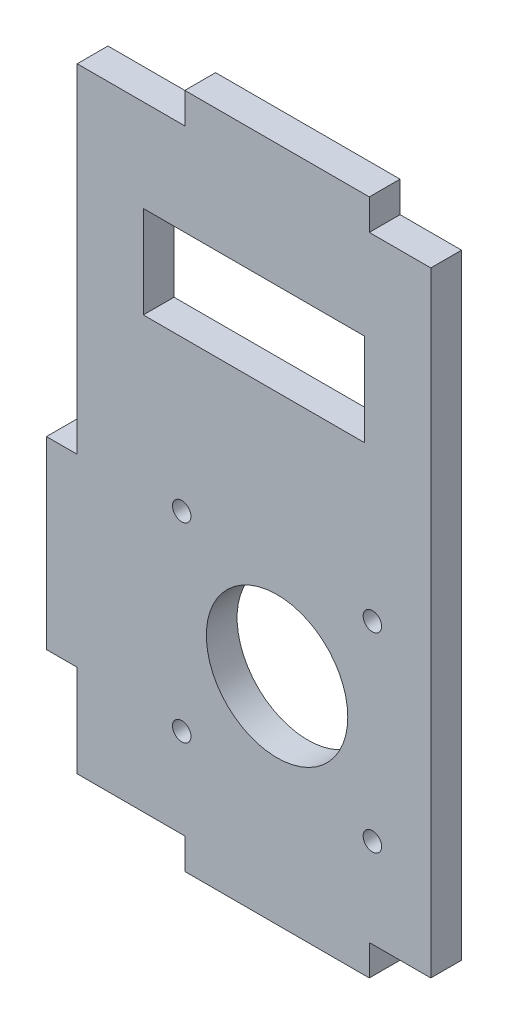
from build123d import *

# Parameters (mm, degrees)
SKETCH_1_R      = 11.5
SKETCH_1_R_2    = 1.5
SKETCH_1_W      = 36
SKETCH_1_H      = 15
EXTRUDE_1_DEPTH = 5


with BuildPart() as part:
    # 草图1 → 凸台-拉伸1 (new body)
    with BuildSketch(Plane.XY):
        Polygon((-2.5, 100), (15, 100), (15, 105), (45, 105), (45, 100), (55, 100), (55, 0), (45, 0), (45, -5), (15, -5), (15, 0), (-2.5, 0), (-2.5, 15), (-7.5, 15), (-7.5, 45), (-2.5, 45), align=None)
        with Locations((30, 30)):
            Circle(SKETCH_1_R, mode=Mode.SUBTRACT)
        with Locations((14.5, 45.5)):
            Circle(SKETCH_1_R_2, mode=Mode.SUBTRACT)
        with Locations((45.5, 45.5)):
            Circle(SKETCH_1_R_2, mode=Mode.SUBTRACT)
        with Locations((45.5, 14.5)):
            Circle(SKETCH_1_R_2, mode=Mode.SUBTRACT)
        with Locations((14.5, 14.5)):
            Circle(SKETCH_1_R_2, mode=Mode.SUBTRACT)
        with Locations((26.25, 77.5)):
            Rectangle(SKETCH_1_W, SKETCH_1_H, mode=Mode.SUBTRACT)
    extrude(amount=EXTRUDE_1_DEPTH)


solid = part.part
